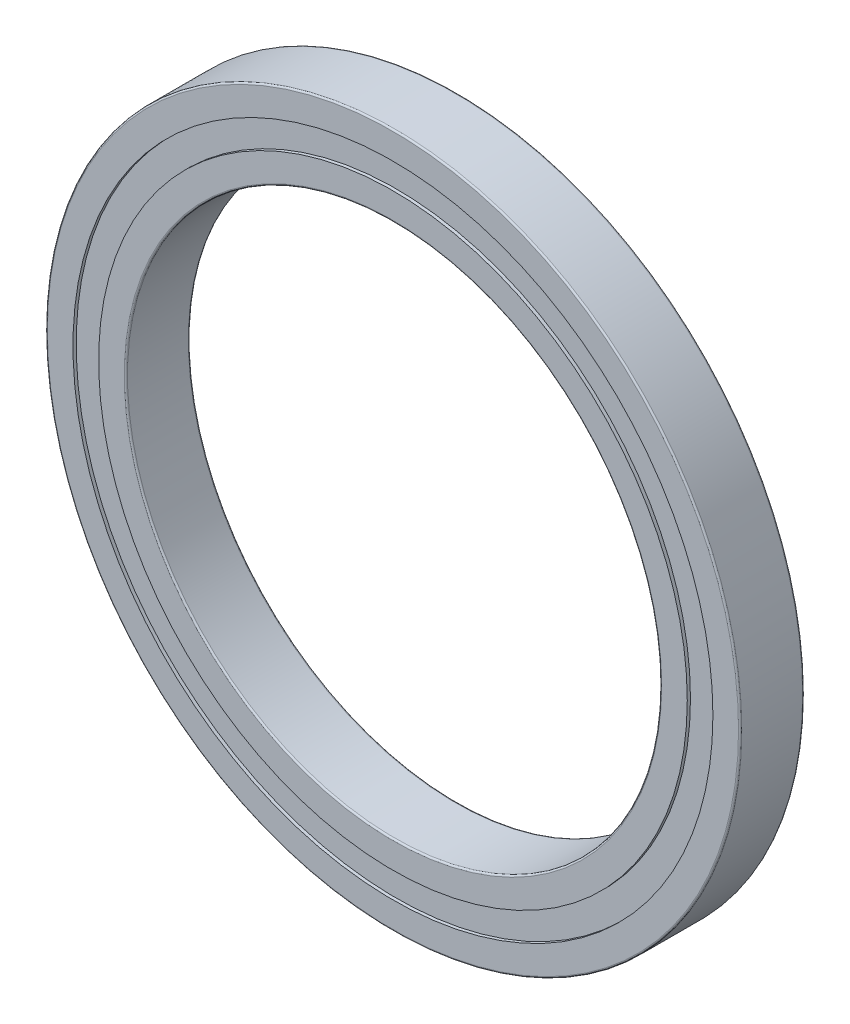
from build123d import *

# Parameters (mm, degrees)
SKETCH1_R           = 32.5
SKETCH1_R_2         = 25
BOSS_EXTRUDE1_DEPTH = 6
SKETCH2_R           = 29.95
SKETCH2_R_2         = 27.55
CUT_EXTRUDE1_DEPTH  = 0.3
CUT_EXTRUDE2_START  = -5.5
SKETCH2_2_R         = 29.95
SKETCH2_2_R_2       = 27.55
CUT_EXTRUDE2_DEPTH  = 0.5
FILLET1_R           = 0.15


with BuildPart() as part:
    # Sketch1 → Boss-Extrude1 (new body)
    with BuildSketch(Plane.XY):
        Circle(SKETCH1_R)
        Circle(SKETCH1_R_2, mode=Mode.SUBTRACT)
    extrude(amount=BOSS_EXTRUDE1_DEPTH)

    # Sketch2 → Cut-Extrude1 (cut)
    with BuildSketch(Plane.XY.offset(6)):
        Circle(SKETCH2_R)
        Circle(SKETCH2_R_2, mode=Mode.SUBTRACT)
    extrude(amount=-CUT_EXTRUDE1_DEPTH, mode=Mode.SUBTRACT)

    # Sketch2<2> → Cut-Extrude2 (cut)
    with BuildSketch(Plane.XY.offset(6).offset(CUT_EXTRUDE2_START)):
        Circle(SKETCH2_2_R)
        Circle(SKETCH2_2_R_2, mode=Mode.SUBTRACT)
    extrude(amount=-CUT_EXTRUDE2_DEPTH, mode=Mode.SUBTRACT)

    # Fillet1
    fillet1_edges = [part.edges().sort_by_distance(p)[0] for p in [
        (-32.5, 0, 0),
        (-32.5, 0, 6),
        (-25, 0, 0),
        (-25, 0, 6),
    ]]
    fillet(fillet1_edges, radius=FILLET1_R)


solid = part.part
